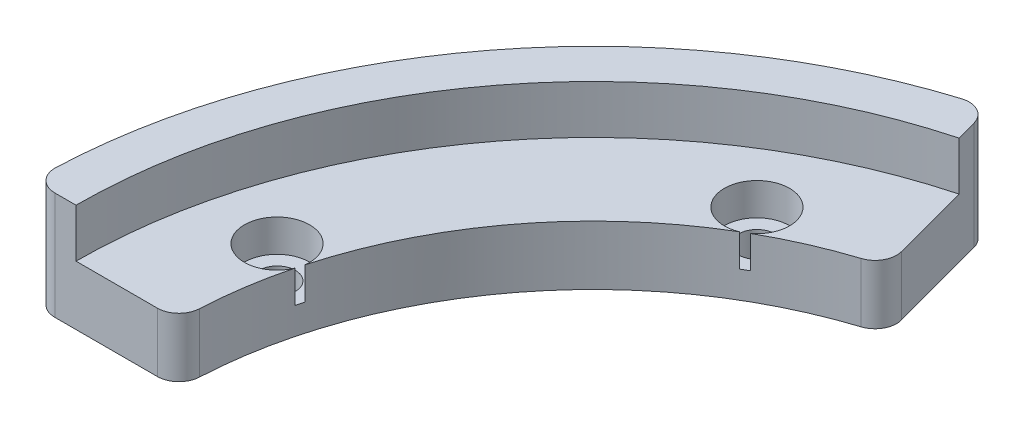
from build123d import *

# Parameters (mm, degrees)
REVOLVE_1_ANGLE             = 75
HOLE_WIZARD_M31_D           = 3.4
HOLE_WIZARD_M31_CBORE_D     = 6.05
HOLE_WIZARD_M31_CBORE_DEPTH = 3
FILLET_1_R                  = 2


with BuildPart() as part:
    # Эскиз1 → Повернуть1 (revolve)
    with BuildSketch(Plane.XY):
        Polygon((-52, 0), (-38.5, 0), (-38.5, 5.5), (-48, 5.5), (-48, 10), (-52, 10), align=None)
    revolve(axis=Axis((0, 0, 0), (0, -1, 0)), revolution_arc=REVOLVE_1_ANGLE)

    # Цековка для винта с заклепочной головкой M31 (through all)
    with Locations(Plane(origin=(0, 5.5, 0), x_dir=(1, 0, 0), z_dir=(0, 1, 0))):
        with Locations((-20.75, 35.940054257), (-40.085921791, 10.740990372)):
            CounterBoreHole(HOLE_WIZARD_M31_D / 2, HOLE_WIZARD_M31_CBORE_D / 2, HOLE_WIZARD_M31_CBORE_DEPTH)

    # Скругление1
    fillet_1_edges = [part.edges().sort_by_distance(p)[0] for p in [
        (-9.964533236, 2.75, -37.188144312),
        (-13.458590345, 5, -50.228142967),
        (-52, 5, 0),
        (-38.5, 2.75, 0),
    ]]
    fillet(fillet_1_edges, radius=FILLET_1_R)


solid = part.part
